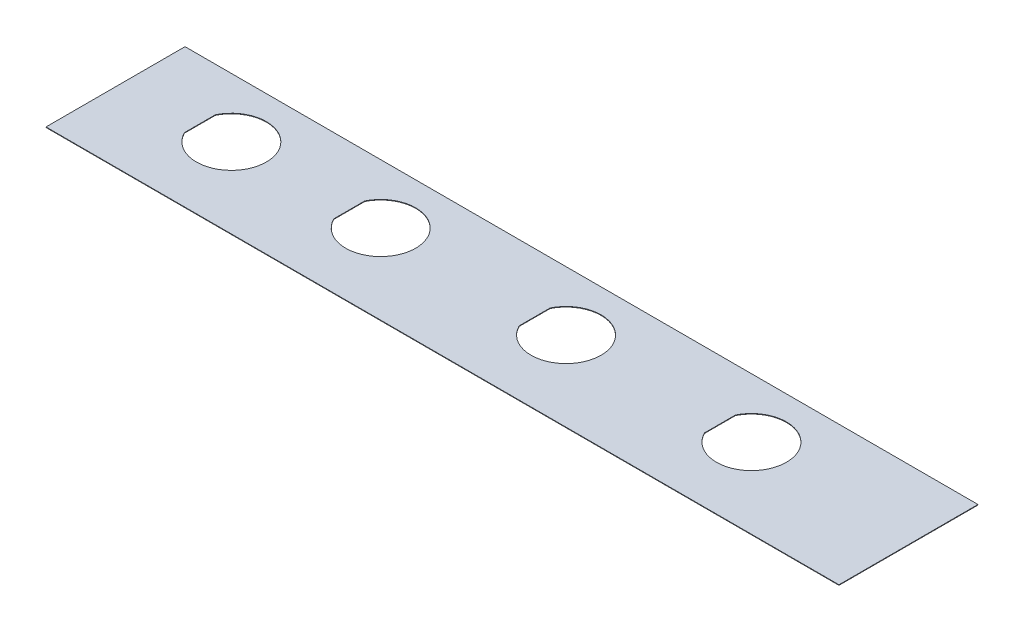
from build123d import *

# Parameters (mm, degrees)
SKETCH1_W           = 154
SKETCH1_H           = 27
BOSS_EXTRUDE1_DEPTH = 0.1
CUT_EXTRUDE1_DEPTH  = 79.174548288


with BuildPart() as part:
    # Sketch1 → Boss-Extrude1 (new body)
    with BuildSketch(Plane(origin=(0, 0, 0), x_dir=(1, 0, 0), z_dir=(0, 1, 0))):
        Rectangle(SKETCH1_W, SKETCH1_H)
    extrude(amount=BOSS_EXTRUDE1_DEPTH)

    # Sketch2 → Cut-Extrude1 (cut, through all)
    with BuildSketch(Plane(origin=(0, 0.1, 0), x_dir=(1, 0, 0), z_dir=(0, 1, 0))):
        with BuildLine():
            Line((2.4, 5.00499584), (2.4, -1.00499584))
            ThreePointArc((2.4, -1.00499584), (15.3, 2), (2.4, 5.00499584))
        make_face()
        with BuildLine():
            Line((38.4, 5.00499584), (38.4, -1.00499584))
            ThreePointArc((38.4, -1.00499584), (51.3, 2), (38.4, 5.00499584))
        make_face()
        with BuildLine():
            Line((-33.6, 5.00499584), (-33.6, -1.00499584))
            ThreePointArc((-33.6, -1.00499584), (-20.7, 2), (-33.6, 5.00499584))
        make_face()
        with BuildLine():
            Line((-62.6, 5.00499584), (-62.6, -1.00499584))
            ThreePointArc((-62.6, -1.00499584), (-49.7, 2), (-62.6, 5.00499584))
        make_face()
    extrude(amount=-CUT_EXTRUDE1_DEPTH, mode=Mode.SUBTRACT)


solid = part.part
